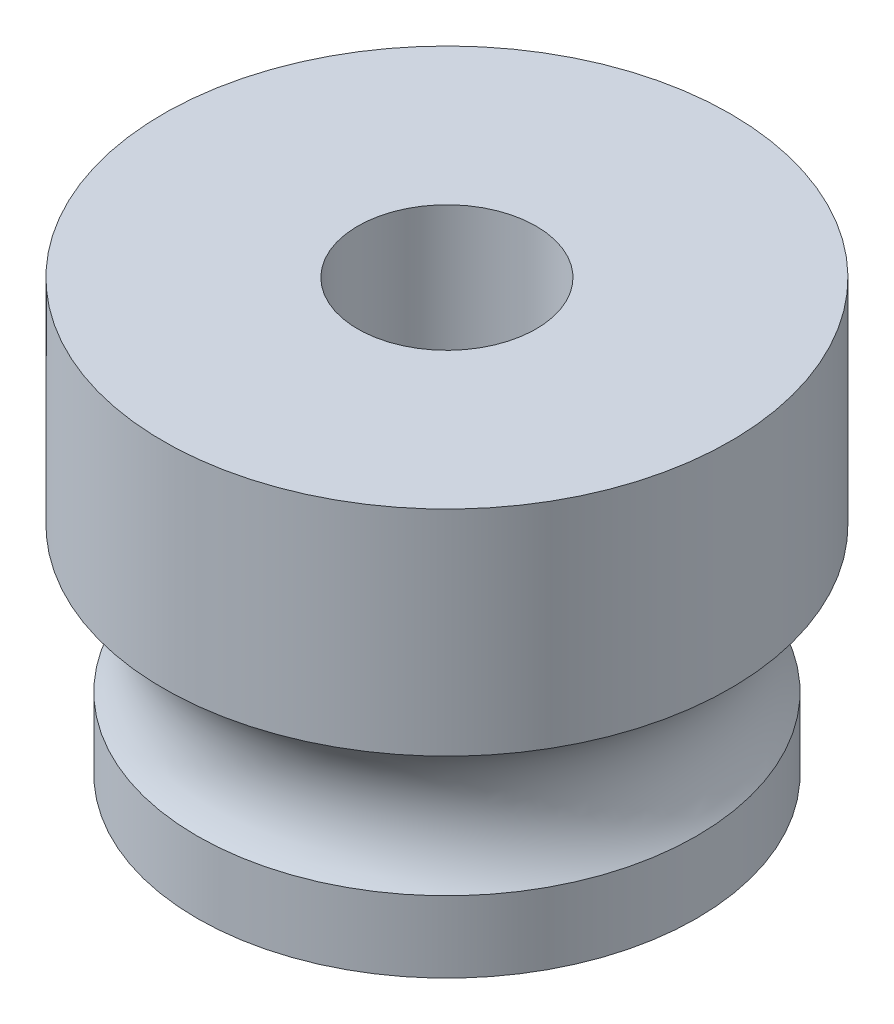
from build123d import *

# Parameters (mm, degrees)
FORO_FILETTATO_M3X0_5_1_D = 2.5


with BuildPart() as part:
    # Schizzo1 → Rivoluzione1 (revolve)
    with BuildSketch(Plane.XY, mode=Mode.PRIVATE) as rivoluzione1_sk:
        with BuildLine():
            Line((0, 6.03), (0, 0))
            Line((0, 0), (3.5, 0))
            Line((3.5, 0), (3.5, 1))
            ThreePointArc((3.5, 1), (3.230499606, 2.133633097), (3.975, 3.03))
            Line((3.975, 3.03), (3.975, 6.03))
            Line((3.975, 6.03), (0, 6.03))
        make_face()
    revolve(rivoluzione1_sk.sketch.rotate(Axis((0, -9.6438806, 0), (0, 1, 0)), 90), axis=Axis((0, -9.6438806, 0), (0, 1, 0)))

    # Foro filettato M3x0.5-1 (through all)
    with Locations(Plane(origin=(0, 0, 0), x_dir=(-1, 0, 0), z_dir=(0, -1, 0))):
        with Locations((0, 0)):
            Hole(FORO_FILETTATO_M3X0_5_1_D / 2)


solid = part.part
